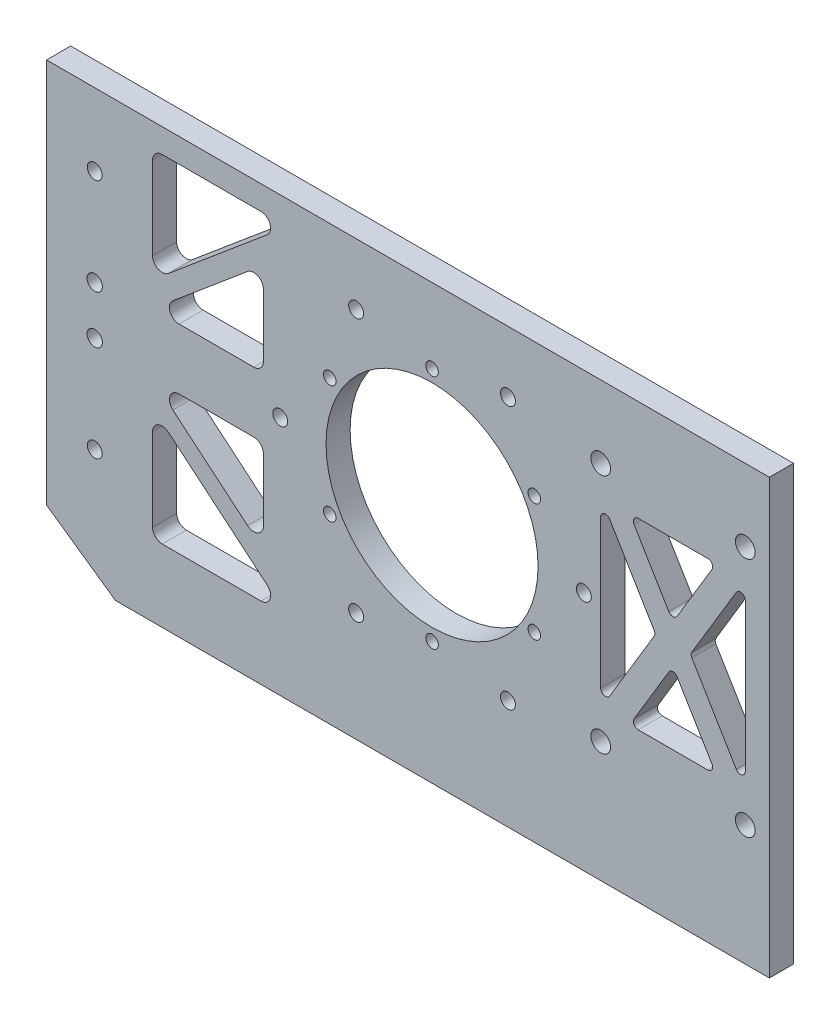
from build123d import *

# Parameters (mm, degrees)
SKETCH_1_W             = 150
SKETCH_1_H             = 80
SKETCH_1_R             = 1.3
SKETCH_1_R_2           = 22
EXTRUDE_1_DEPTH        = 5
SKETCH_3_R             = 1.55
SKETCH_3_R_2           = 1.582849294
CUT_EXTRUDE_3_DEPTH    = 12.5
CUT_EXTRUDE_5_DEPTH    = 8
FILLET_3_R             = 2
FILLET_3_OF_MIRROR_2_R = 2
EXTRUDE_4_DEPTH        = 5
FILLET_5_R             = 5
SKETCH_11_R            = 1.55
CUT_EXTRUDE_7_DEPTH    = 25
SKETCH_12_R            = 2.05
CUT_EXTRUDE_8_DEPTH    = 10
CUT_EXTRUDE_9_DEPTH    = 10
FILLET_6_R             = 1
EXTRUDE_5_DEPTH        = 5
SKETCH_16_R            = 2.25
CUT_EXTRUDE_10_DEPTH   = 2.5
CUT_EXTRUDE_START      = -10
CUT_EXTRUDE_11_DEPTH   = 10


with BuildPart() as part:
    # 草图1 → 凸台-拉伸1 (new body)
    with BuildSketch(Plane.XY):
        with Locations((-5, 0)):
            Rectangle(SKETCH_1_W, SKETCH_1_H)
        with Locations((0, -24.5)):
            Circle(SKETCH_1_R, mode=Mode.SUBTRACT)
        with Locations((-21.217622393, -12.25)):
            Circle(SKETCH_1_R, mode=Mode.SUBTRACT)
        with Locations((-21.217622393, 12.25)):
            Circle(SKETCH_1_R, mode=Mode.SUBTRACT)
        Circle(SKETCH_1_R_2, mode=Mode.SUBTRACT)
        with Locations((0, 24.5)):
            Circle(SKETCH_1_R, mode=Mode.SUBTRACT)
        with Locations((21.217622393, 12.25)):
            Circle(SKETCH_1_R, mode=Mode.SUBTRACT)
        with Locations((21.217622393, -12.25)):
            Circle(SKETCH_1_R, mode=Mode.SUBTRACT)
    extrude(amount=EXTRUDE_1_DEPTH)

    # 草图3 → 切除-拉伸3 (cut)
    with BuildSketch(Plane.XY.offset(5)):
        with Locations((-70, -25)):
            Circle(SKETCH_3_R)
        with Locations((-70, -5)):
            Circle(SKETCH_3_R_2)
        with Locations((-70, 25)):
            Circle(SKETCH_3_R)
        with Locations((-70, 5)):
            Circle(SKETCH_3_R_2)
    extrude(amount=-CUT_EXTRUDE_3_DEPTH, mode=Mode.SUBTRACT)

    # 草图4 → 切除-拉伸5 (cut)
    with BuildSketch(Plane.XY.offset(5)):
        Polygon((-58, 35), (-30, 35), (-58, 11.505210327), align=None)
        Polygon((-35, 25.582872687), (-58, 6.28358117), (-35, 6.28358117), align=None)
    cut_extrude_5 = extrude(amount=-CUT_EXTRUDE_5_DEPTH, mode=Mode.SUBTRACT)

    # 圆角3
    fillet_3_edges = [part.edges().sort_by_distance(p)[0] for p in [
        (-35, 6.28358117, 2.5),
        (-58, 6.28358117, 2.5),
        (-35, 25.582872687, 2.5),
        (-30, 35, 2.5),
        (-58, 11.505210327, 2.5),
        (-58, 35, 2.5),
    ]]
    fillet(fillet_3_edges, radius=FILLET_3_R)

    # 镜向2: 切除-拉伸5 across plane
    add(cut_extrude_5.mirror(Plane.ZX), mode=Mode.SUBTRACT)

    # 圆角3 of 镜向2
    fillet_3_of_mirror_2_edges = [part.edges().sort_by_distance(p)[0] for p in [
        (-35, -6.28358117, 2.5),
        (-58, -6.28358117, 2.5),
        (-35, -25.582872687, 2.5),
        (-30, -35, 2.5),
        (-58, -11.505210327, 2.5),
        (-58, -35, 2.5),
    ]]
    fillet(fillet_3_of_mirror_2_edges, radius=FILLET_3_OF_MIRROR_2_R)

    # 草图10 → 凸台-拉伸4 (add)
    with BuildSketch(Plane.XY.offset(5)):
        Polygon((-80, -40), (-127.053079228, -7.053079228), (-80, 40), align=None)
    extrude(amount=-EXTRUDE_4_DEPTH)

    # 圆角5
    fillet_5_edges = [part.edges().sort_by_distance(p)[0] for p in [
        (-127.053079228, -7.053079228, 2.5),
    ]]
    fillet(fillet_5_edges, radius=FILLET_5_R)

    # 草图11 → 切除-拉伸7 (cut)
    with BuildSketch(Plane.XY.offset(5)):
        with Locations((-15.75, 27.279800219)):
            Circle(SKETCH_11_R)
        with Locations((15.75, 27.279800219)):
            Circle(SKETCH_11_R)
        with Locations((31.5, 0)):
            Circle(SKETCH_11_R)
        with Locations((15.75, -27.279800219)):
            Circle(SKETCH_11_R)
        with Locations((-15.75, -27.279800219)):
            Circle(SKETCH_11_R)
        with Locations((-31.5, 0)):
            Circle(SKETCH_11_R)
    extrude(amount=-CUT_EXTRUDE_7_DEPTH, mode=Mode.SUBTRACT)

    # 草图12 → 切除-拉伸8 (cut)
    with BuildSketch(Plane.XY.offset(5)):
        with Locations((35, 25)):
            Circle(SKETCH_12_R)
        with Locations((65, 25)):
            Circle(SKETCH_12_R)
        with Locations((65, -25)):
            Circle(SKETCH_12_R)
        with Locations((35, -25)):
            Circle(SKETCH_12_R)
    extrude(amount=-CUT_EXTRUDE_8_DEPTH, mode=Mode.SUBTRACT)

    # 草图13 → 切除-拉伸9 (cut)
    with BuildSketch(Plane.XY.offset(5)):
        Polygon((35, 19), (35, -19), (46.4, 0), align=None)
        Polygon((65, -19), (53.6, 0), (65, 19), align=None)
        Polygon((41, 19), (50, 4), (59, 19), align=None)
        Polygon((50, -4), (59, -19), (41, -19), align=None)
    extrude(amount=-CUT_EXTRUDE_9_DEPTH, mode=Mode.SUBTRACT)

    # 圆角6
    fillet_6_edges = [part.edges().sort_by_distance(p)[0] for p in [
        (41, 19, 2.5),
        (59, 19, 2.5),
        (50, 4, 2.5),
        (65, 19, 2.5),
        (65, -19, 2.5),
        (53.6, 0, 2.5),
        (41, -19, 2.5),
        (50, -4, 2.5),
        (59, -19, 2.5),
        (35, 19, 2.5),
        (46.4, 0, 2.5),
        (35, -19, 2.5),
    ]]
    fillet(fillet_6_edges, radius=FILLET_6_R)

    # 草图14 → 凸台-拉伸5 (add)
    with BuildSketch(Plane.XY.offset(5)):
        Polygon((-80, -40), (-65.718519933, -50), (70, -50), (70, -40), align=None)
    extrude(amount=-EXTRUDE_5_DEPTH)

    # 草图16 → 切除-拉伸10 (cut)
    with BuildSketch(Plane(origin=(0, 0, 0), x_dir=(-1, 0, 0), z_dir=(0, 0, -1))):
        with Locations((0, 24.5)):
            Circle(SKETCH_16_R)
        with Locations((21.217622393, 12.25)):
            Circle(SKETCH_16_R)
        with Locations((21.217622393, -12.25)):
            Circle(SKETCH_16_R)
        with Locations((0, -24.5)):
            Circle(SKETCH_16_R)
        with Locations((-21.217622393, -12.25)):
            Circle(SKETCH_16_R)
        with Locations((-21.217622393, 12.25)):
            Circle(SKETCH_16_R)
    extrude(amount=-CUT_EXTRUDE_10_DEPTH, mode=Mode.SUBTRACT)

    # 草图17 → 切除-拉伸11 (cut)
    with BuildSketch(Plane.XY.offset(5).offset(CUT_EXTRUDE_START)):
        with BuildLine():
            Line((-122.839593994, -2.839593994), (-80, 40))
            Line((-80, 40), (-80, 0))
            Line((-80, 0), (-80, -40))
            Line((-80, -40), (-122.17194227, -10.470888122))
            ThreePointArc((-122.17194227, -10.470888122), (-124.285033579, -6.810906614), (-122.839593994, -2.839593994))
        make_face()
    extrude(amount=CUT_EXTRUDE_11_DEPTH, mode=Mode.SUBTRACT)


solid = part.part
